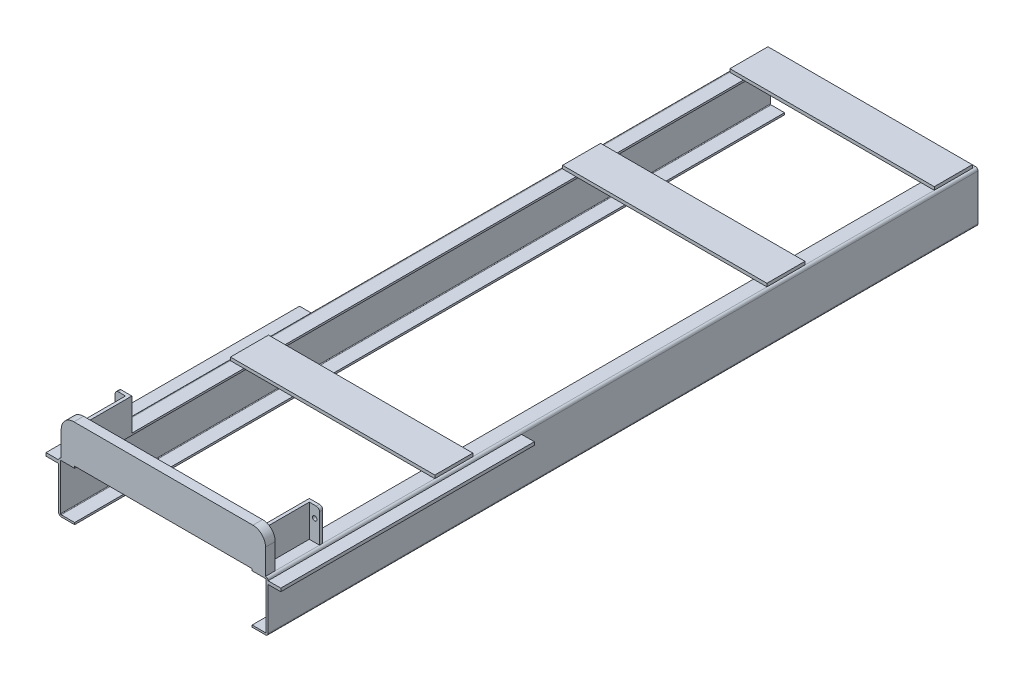
from build123d import *

# Parameters (mm, degrees)
EXTRUDE_THIN1_DEPTH  = 1400
SKETCH2_W            = 50
SKETCH2_H            = 12.5
BOSS_EXTRUDE1_DEPTH  = 1000
BOSS_EXTRUDE2_DEPTH  = 38
SKETCH4_W            = 806
SKETCH4_H            = 150
BOSS_EXTRUDE3_DEPTH  = 12.5
LPATTERN1_COUNT      = 2
LPATTERN1_PITCH      = 660
LPATTERN2_COUNT      = 2
LPATTERN2_PITCH      = 1970
SKETCH5_W            = 12.5
SKETCH5_H            = 127
BOSS_EXTRUDE4_DEPTH  = 175
SKETCH6_W            = 53
SKETCH6_H            = 127
SKETCH6_R            = 8.75
BOSS_EXTRUDE5_DEPTH  = 12.5
FILLET1_R            = 12.5
FILLET1_OF_MIRROR3_R = 12.5


with BuildPart() as part:
    # Sketch1 → Extrude-Thin1 (new, symmetric)
    with BuildSketch(Plane.XY):
        with BuildLine():
            Line((350, 100), (403, 100))
            ThreePointArc((403, 100), (410.071067812, 97.071067812), (413, 90))
            Line((413, 90), (413, -90))
            ThreePointArc((413, -90), (410.071067812, -97.071067812), (403, -100))
            Line((403, -100), (350, -100))
            Line((350, -100), (350, -92.5))
            Line((350, -92.5), (403, -92.5))
            ThreePointArc((403, -92.5), (404.767766953, -91.767766953), (405.5, -90))
            Line((405.5, -90), (405.5, 90))
            ThreePointArc((405.5, 90), (404.767766953, 91.767766953), (403, 92.5))
            Line((403, 92.5), (350, 92.5))
            Line((350, 92.5), (350, 100))
        make_face()
    extrude(amount=EXTRUDE_THIN1_DEPTH, both=True)

    # Sketch2 → Boss-Extrude1 (add)
    with BuildSketch(Plane.XY.offset(1400)):
        with Locations((438, 83.75)):
            Rectangle(SKETCH2_W, SKETCH2_H)
    extrude(amount=-BOSS_EXTRUDE1_DEPTH)


with BuildPart() as body_2:
    # Mirror2: mirrored copy
    add(part.part.mirror(Plane(origin=(0, 0, 0), x_dir=(0, 0, 1), z_dir=(1, 0, 0))))


with BuildPart() as part_1:
    add(part.part)

    add(body_2.part)  # Boss-Extrude2 merges body 2
    # Sketch3 → Boss-Extrude2 (add)
    with BuildSketch(Plane.XY.offset(1400)):
        with BuildLine():
            Line((-403, 100), (403, 100))
            Line((403, 100), (403, 200))
            ThreePointArc((403, 200), (388.355339059, 235.355339059), (353, 250))
            Line((353, 250), (-353, 250))
            ThreePointArc((-353, 250), (-388.355339059, 235.355339059), (-403, 200))
            Line((-403, 200), (-403, 100))
        make_face()
    extrude(amount=-BOSS_EXTRUDE2_DEPTH)

    # Sketch4 → Boss-Extrude3 (add)
    with BuildSketch(Plane(origin=(0, 100, 0), x_dir=(1, 0, 0), z_dir=(0, 1, 0))):
        with Locations((0, 1312.5)):
            Rectangle(SKETCH4_W, SKETCH4_H)
    boss_extrude3 = extrude(amount=BOSS_EXTRUDE3_DEPTH)

    # LPattern1: Boss-Extrude3 ×2
    with Locations(*[(0, 0, i * LPATTERN1_PITCH) for i in range(1, LPATTERN1_COUNT)]):
        add(boss_extrude3)

    # LPattern2: Boss-Extrude3 ×2
    with Locations(*[(0, 0, i * LPATTERN2_PITCH) for i in range(1, LPATTERN2_COUNT)]):
        add(boss_extrude3)

    # Sketch5 → Boss-Extrude4 (add)
    with BuildSketch(Plane(origin=(0, 0, 1362), x_dir=(-1, 0, 0), z_dir=(0, 0, -1))):
        with Locations((-356.25, 163.5)):
            Rectangle(SKETCH5_W, SKETCH5_H)
    boss_extrude4 = extrude(amount=BOSS_EXTRUDE4_DEPTH)

    # Sketch6 → Boss-Extrude5 (add)
    with BuildSketch(Plane(origin=(0, 0, 1187), x_dir=(-1, 0, 0), z_dir=(0, 0, -1))):
        with Locations((-376.5, 163.5)):
            Rectangle(SKETCH6_W, SKETCH6_H)
        with Locations((-384, 182)):
            Circle(SKETCH6_R, mode=Mode.SUBTRACT)
    boss_extrude5 = extrude(amount=BOSS_EXTRUDE5_DEPTH)

    # Fillet1
    fillet1_edges = [part_1.edges().sort_by_distance(p)[0] for p in [
        (403, 227, 1180.75),
    ]]
    fillet(fillet1_edges, radius=FILLET1_R)

    # Mirror3: Boss-Extrude4, Boss-Extrude5 across plane
    add(boss_extrude4.mirror(Plane(origin=(0, 0, 0), x_dir=(0, 0, 1), z_dir=(1, 0, 0))))
    add(boss_extrude5.mirror(Plane(origin=(0, 0, 0), x_dir=(0, 0, 1), z_dir=(1, 0, 0))))

    # Fillet1 of Mirror3
    fillet1_of_mirror3_edges = [part_1.edges().sort_by_distance(p)[0] for p in [
        (-403, 227, 1180.75),
    ]]
    fillet(fillet1_of_mirror3_edges, radius=FILLET1_OF_MIRROR3_R)


solid = part_1.part
